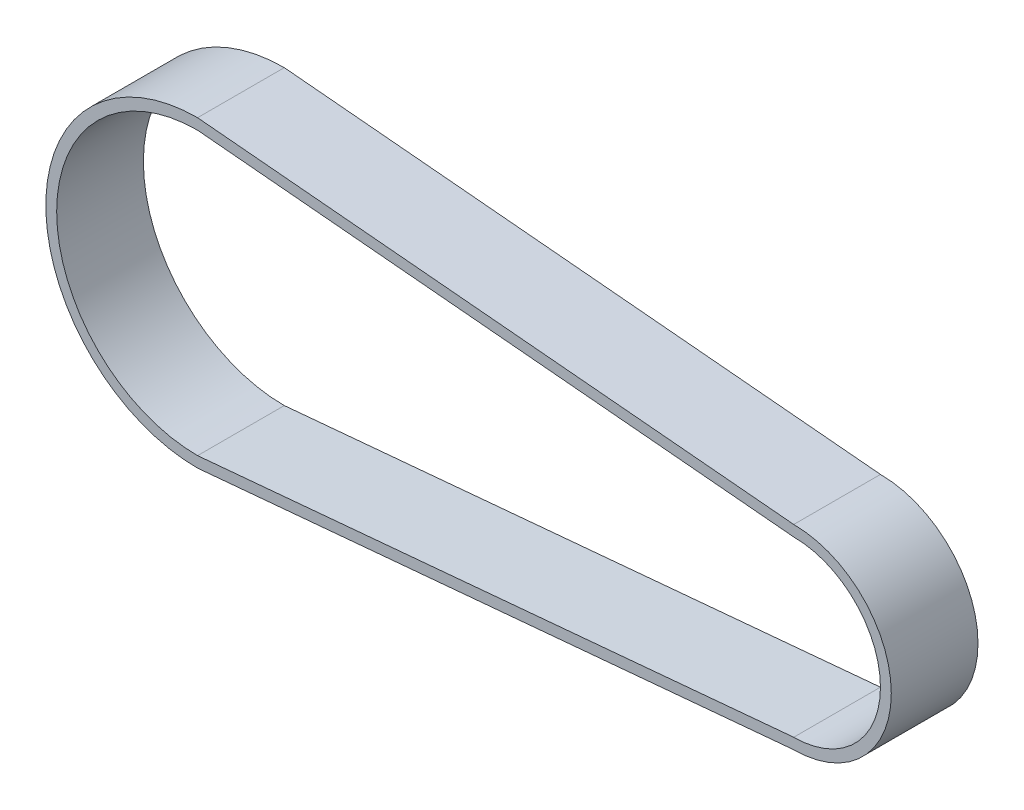
from build123d import *

# Parameters (mm, degrees)
BOSS_EXTRU_1_DEPTH = 8


with BuildPart() as part:
    # Esquisse1 → Boss.-Extru.1 (new body)
    with BuildSketch(Plane.XY):
        with BuildLine():
            Line((-30, 14), (25, 9))
            ThreePointArc((25, 9), (34, 0), (25, -9))
            Line((25, -9), (-30, -14))
            ThreePointArc((-30, -14), (-44, 0), (-30, 14))
        make_face()
        with BuildLine():
            Line((-30, -13), (25, -8))
            ThreePointArc((25, -8), (33, 0), (25, 8))
            Line((25, 8), (-30, 13))
            ThreePointArc((-30, 13), (-43, 0), (-30, -13))
        make_face(mode=Mode.SUBTRACT)
    extrude(amount=BOSS_EXTRU_1_DEPTH)


solid = part.part
